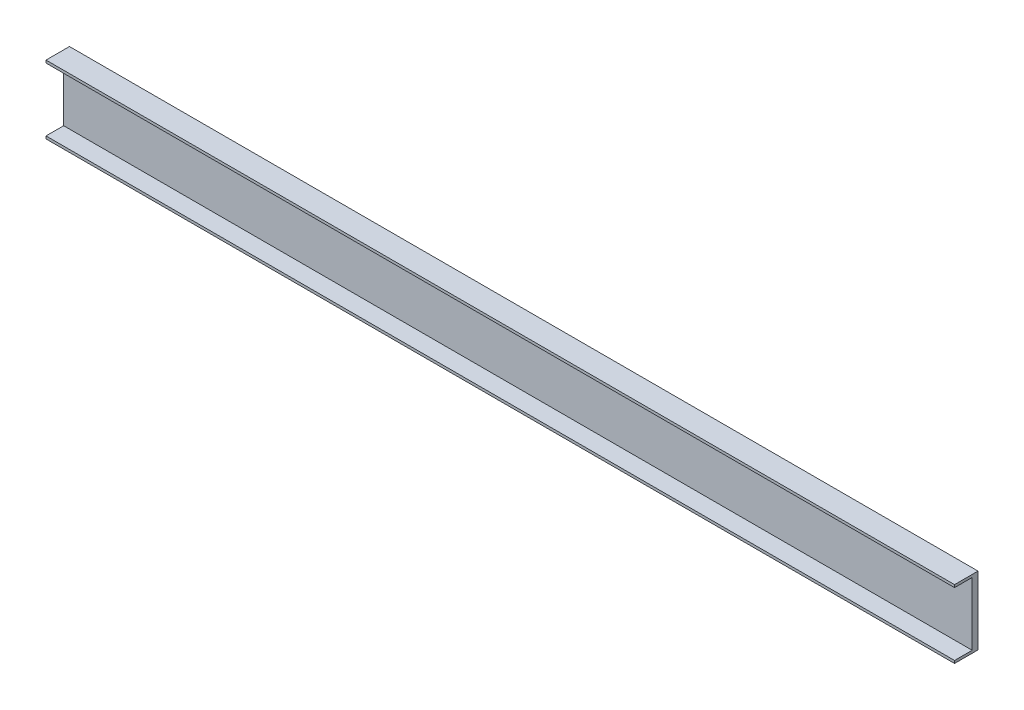
from build123d import *

# Parameters (mm, degrees)
SKETCH_1_W         = 3990
SKETCH_1_H         = 300
EXTRUDE_1314_DEPTH = 25.5
SKETCH_2_W         = 3990
SKETCH_2_H         = 11.5
EXTRUDE_1_DEPTH    = 77.5
SKETCH_3_W         = 70
SKETCH_3_H         = 230
EXTRUDE_2_DEPTH    = 16


with BuildPart() as part:
    # 草图1 → Extrude 1314 (new body)
    with BuildSketch(Plane.XY):
        Rectangle(SKETCH_1_W, SKETCH_1_H)
    extrude(amount=EXTRUDE_1314_DEPTH)

    # 草图2 → 凸台-拉伸1 (add)
    with BuildSketch(Plane.XY.offset(25.5)):
        with Locations((0, 144.25)):
            Rectangle(SKETCH_2_W, SKETCH_2_H)
        with Locations((0, -144.25)):
            Rectangle(SKETCH_2_W, SKETCH_2_H)
    extrude(amount=EXTRUDE_1_DEPTH)

    # 草图3 → 凸台-拉伸2 (add)
    with BuildSketch(Plane(origin=(0, 0, 0), x_dir=(-1, 0, 0), z_dir=(0, 0, -1))):
        with Locations((1300, 0)):
            Rectangle(SKETCH_3_W, SKETCH_3_H)
        with Locations((900, 0)):
            Rectangle(SKETCH_3_W, SKETCH_3_H)
        with Locations((-1300, 0)):
            Rectangle(SKETCH_3_W, SKETCH_3_H)
        with Locations((500, 0)):
            Rectangle(SKETCH_3_W, SKETCH_3_H)
        with Locations((-900, 0)):
            Rectangle(SKETCH_3_W, SKETCH_3_H)
        with Locations((-500, 0)):
            Rectangle(SKETCH_3_W, SKETCH_3_H)
    extrude(amount=EXTRUDE_2_DEPTH)


solid = part.part
